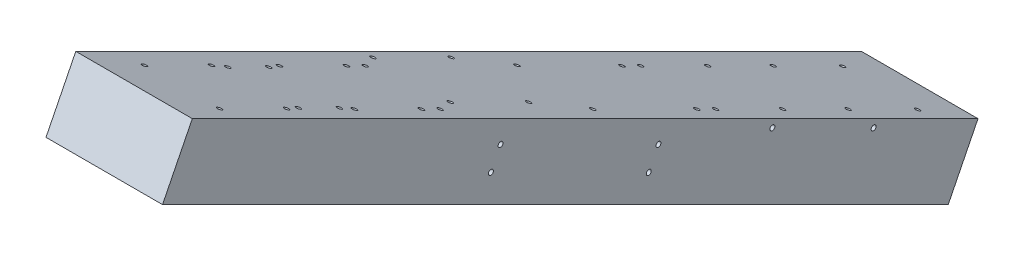
from build123d import *

# Parameters (mm, degrees)
SKETCH_2_W          = 1055.327979506
SKETCH_2_H          = 140
SKETCH_2_R          = 3
SKETCH_2_R_2        = 2.999999994
SKETCH_2_R_3        = 3.000000004
SKETCH_2_R_4        = 3.000000008
SKETCH_2_R_5        = 2.984817456
EXTRUDE_1_DEPTH     = 80
SKETCH_3_R          = 3
SKETCH_3_R_2        = 3.000000003
SKETCH_3_R_3        = 2.999999996
CUT_EXTRUDE_1_DEPTH = 10


with BuildPart() as part:
    # Эскиз2 → Бобышка-Вытянуть1 (new body)
    with BuildSketch(Plane(origin=(35, -236.577126762, 8.404450588), x_dir=(-1.3965925355372533e-14, -0.44721359549995804, -0.8944271909999159), z_dir=(2.4440369371901933e-14, -0.8944271909999159, 0.44721359549995804))):
        with Locations((247.509812295, 0)):
            Rectangle(SKETCH_2_W, SKETCH_2_H)
        with Locations((-220.154177458, 48.999999999)):
            Circle(SKETCH_2_R, mode=Mode.SUBTRACT)
        with Locations((-130.154177458, 49)):
            Circle(SKETCH_2_R, mode=Mode.SUBTRACT)
        with Locations((-220.154177458, -41.000000001)):
            Circle(SKETCH_2_R, mode=Mode.SUBTRACT)
        with Locations((-130.154177458, -41)):
            Circle(SKETCH_2_R, mode=Mode.SUBTRACT)
        with Locations((-40, 50)):
            Circle(SKETCH_2_R, mode=Mode.SUBTRACT)
        with Locations((-40, -40)):
            Circle(SKETCH_2_R, mode=Mode.SUBTRACT)
        with Locations((50, 50)):
            Circle(SKETCH_2_R, mode=Mode.SUBTRACT)
        with Locations((50, -40)):
            Circle(SKETCH_2_R, mode=Mode.SUBTRACT)
        with Locations((75, 50)):
            Circle(SKETCH_2_R, mode=Mode.SUBTRACT)
        with Locations((75, -40)):
            Circle(SKETCH_2_R, mode=Mode.SUBTRACT)
        with Locations((105, -57.5)):
            Circle(SKETCH_2_R, mode=Mode.SUBTRACT)
        with Locations((105, 35.5)):
            Circle(SKETCH_2_R, mode=Mode.SUBTRACT)
        with Locations((210, -57.5)):
            Circle(SKETCH_2_R, mode=Mode.SUBTRACT)
        with Locations((210, 35.5)):
            Circle(SKETCH_2_R, mode=Mode.SUBTRACT)
        with Locations((280, 50)):
            Circle(SKETCH_2_R, mode=Mode.SUBTRACT)
        with Locations((280, -41)):
            Circle(SKETCH_2_R, mode=Mode.SUBTRACT)
        with Locations((420, 50)):
            Circle(SKETCH_2_R, mode=Mode.SUBTRACT)
        with Locations((420, -40)):
            Circle(SKETCH_2_R, mode=Mode.SUBTRACT)
        with Locations((445, 50)):
            Circle(SKETCH_2_R, mode=Mode.SUBTRACT)
        with Locations((445, -40)):
            Circle(SKETCH_2_R, mode=Mode.SUBTRACT)
        with Locations((535, 50)):
            Circle(SKETCH_2_R, mode=Mode.SUBTRACT)
        with Locations((535, -40)):
            Circle(SKETCH_2_R, mode=Mode.SUBTRACT)
        with Locations((623.000000015, 49.999999971)):
            Circle(SKETCH_2_R_2, mode=Mode.SUBTRACT)
        with Locations((715.173802057, 50.999999957)):
            Circle(SKETCH_2_R_3, mode=Mode.SUBTRACT)
        with Locations((623, -40.000000029)):
            Circle(SKETCH_2_R_4, mode=Mode.SUBTRACT)
        with Locations((715.173802043, -39.000000043)):
            Circle(SKETCH_2_R, mode=Mode.SUBTRACT)
        with Locations((-57.5, -37.5)):
            Circle(SKETCH_2_R, mode=Mode.SUBTRACT)
        with Locations((-57.5, 47.5)):
            Circle(SKETCH_2_R, mode=Mode.SUBTRACT)
        with Locations((-112.5, 47.5)):
            Circle(SKETCH_2_R, mode=Mode.SUBTRACT)
        with Locations((-112.484817456, -37.5)):
            Circle(SKETCH_2_R_5, mode=Mode.SUBTRACT)
    extrude(amount=EXTRUDE_1_DEPTH)

    # Эскиз3 → Вырез-Вытянуть1 (cut)
    with BuildSketch(Plane(origin=(105, 0, 0), x_dir=(0, 0, -1), z_dir=(1, 0, 0))):
        with Locations((301.002749958, -418.113542766)):
            Circle(SKETCH_3_R)
        with Locations((289.375196475, -441.368649732)):
            Circle(SKETCH_3_R)
        with Locations((437.902966638, -469.334383556)):
            Circle(SKETCH_3_R)
        with Locations((559.545064612, -530.155432548)):
            Circle(SKETCH_3_R_2)
        with Locations((111.384185469, -323.304260514)):
            Circle(SKETCH_3_R_3)
        with Locations((99.756631986, -346.55936748)):
            Circle(SKETCH_3_R_3)
    extrude(amount=-CUT_EXTRUDE_1_DEPTH, mode=Mode.SUBTRACT)


solid = part.part
